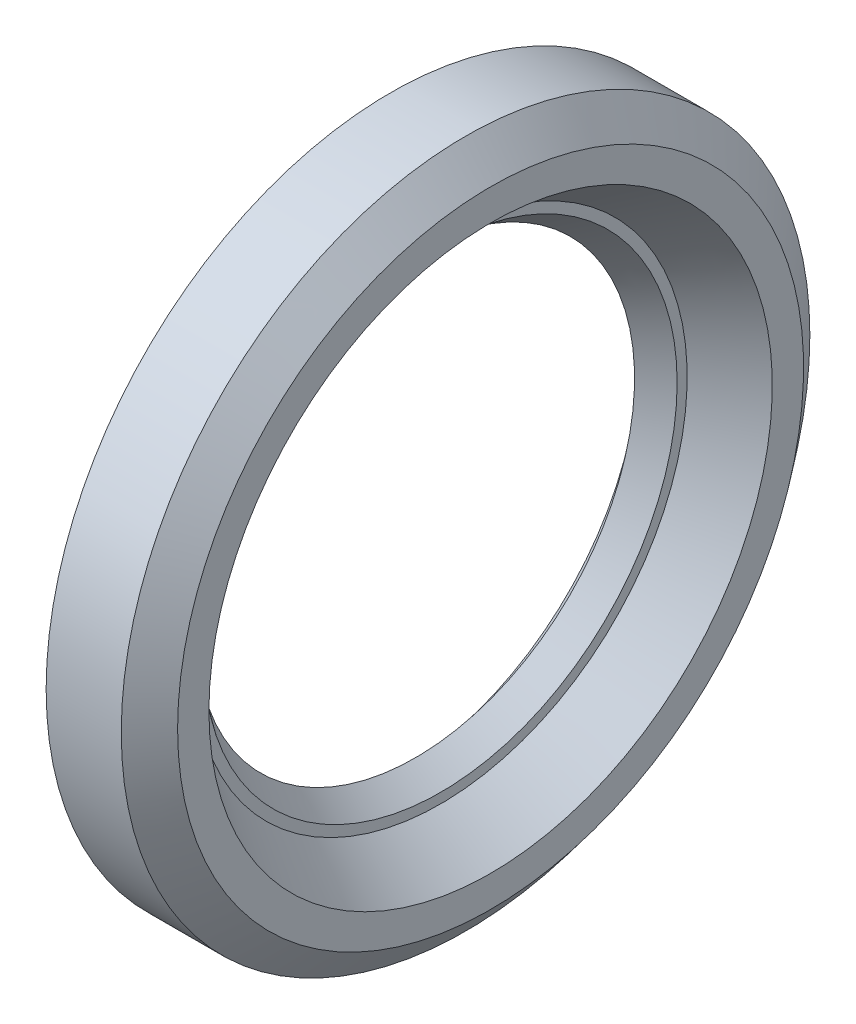
from build123d import *


with BuildPart() as part:
    # Эскиз2 → Повернуть2 (revolve)
    with BuildSketch(Plane.XY, mode=Mode.PRIVATE) as revolve_2_sk:
        Polygon((8, 25), (6, 27.5), (0, 27.5), (0, 25), (4, 25), (4, 22.5), (0.5, 22.5), (0.5, 19.375), (2, 17.5), (4, 18.899869823), (4, 19.700260353), (8, 22.5), align=None)
    revolve(revolve_2_sk.sketch.rotate(Axis((-1000, 0, 0), (1, 0, 0)), 90), axis=Axis((-1000, 0, 0), (1, 0, 0)))


solid = part.part
